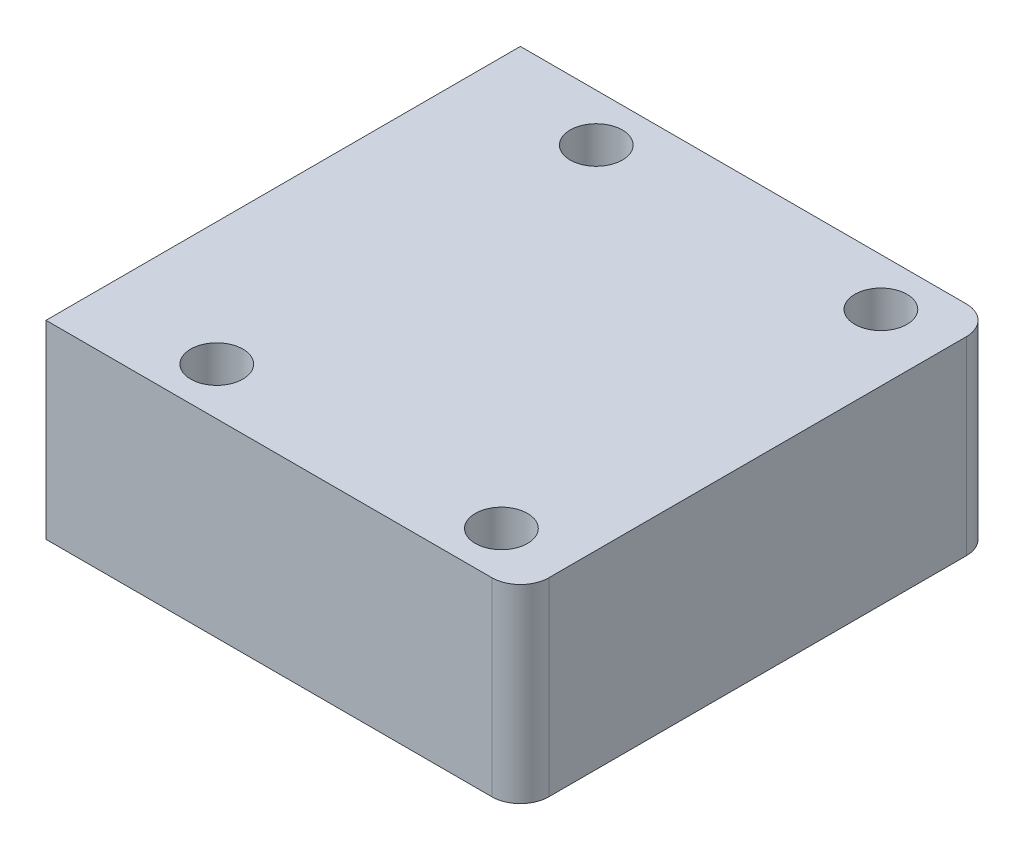
from build123d import *

# Parameters (mm, degrees)
SKETCH1_W           = 50
SKETCH1_H           = 50
SKETCH1_R           = 2.75
BOSS_EXTRUDE1_DEPTH = 20
FILLET1_R           = 3
SKETCH2_R           = 1.4
CUT_EXTRUDE1_DEPTH  = 8


with BuildPart() as part:
    # Sketch1 → Boss-Extrude1 (new body)
    with BuildSketch(Plane(origin=(0, 0, 0), x_dir=(1, 0, 0), z_dir=(0, 1, 0))):
        with Locations((-3, 0)):
            Rectangle(SKETCH1_W, SKETCH1_H)
        with Locations((-15, 20)):
            Circle(SKETCH1_R, mode=Mode.SUBTRACT)
        with Locations((15, 20)):
            Circle(SKETCH1_R, mode=Mode.SUBTRACT)
        with Locations((-15, -20)):
            Circle(SKETCH1_R, mode=Mode.SUBTRACT)
        with Locations((15, -20)):
            Circle(SKETCH1_R, mode=Mode.SUBTRACT)
    extrude(amount=BOSS_EXTRUDE1_DEPTH)

    # Fillet1
    fillet1_edges = [part.edges().sort_by_distance(p)[0] for p in [
        (22, 10, -25),
        (22, 10, 25),
    ]]
    fillet(fillet1_edges, radius=FILLET1_R)

    # Sketch2 → Cut-Extrude1 (cut)
    with BuildSketch(Plane.ZY.offset(28)):
        with Locations((-19, 14)):
            Circle(SKETCH2_R)
        with Locations((0, 4)):
            Circle(SKETCH2_R)
        with Locations((19, 14)):
            Circle(SKETCH2_R)
    extrude(amount=-CUT_EXTRUDE1_DEPTH, mode=Mode.SUBTRACT)


solid = part.part
